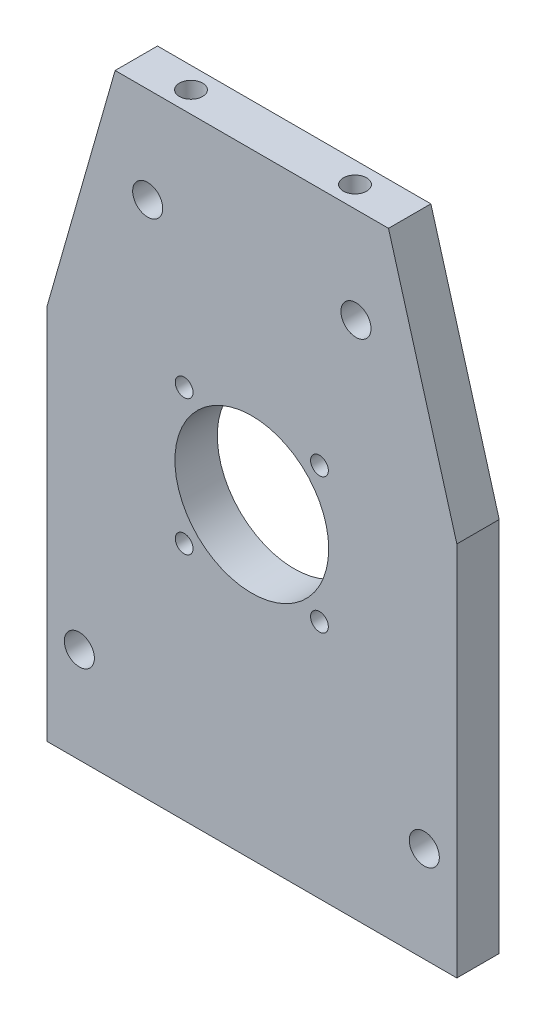
from build123d import *

# Parameters (mm, degrees)
EXTRUDE_1_4_DEPTH       = 3.1
CUT_EXTRUDE2_DEPTH      = 3.1
CUT_EXTRUDE2_DEPTH_BACK = 8
SKETCH3_R               = 11.25
SKETCH2_R               = 1.3
M3_DRILL_DEPTH          = 6.2
SKETCH4_R               = 1.7
M4_DRILL_DEPTH          = 8
SKETCH5_R               = 1.7
M4_DRILL2_DEPTH         = 8
SKETCH6_R               = 2.2
M4_THROUGH_DEPTH        = 6.2


with BuildPart() as part:
    # Sketch1 → 1/4 (new, symmetric)
    with BuildSketch(Plane.XY):
        Polygon((-20, 45), (20, 45), (30, 10), (30, -45), (-30, -45), (-30, 10), align=None)
    extrude(amount=EXTRUDE_1_4_DEPTH, both=True)

    # Sketch3 → Cut-Extrude2 (cut, two sides: drawn at the far end of the back side and taken through both)
    with BuildSketch(Plane.XY.offset(-CUT_EXTRUDE2_DEPTH_BACK)):
        Circle(SKETCH3_R)
    extrude(amount=CUT_EXTRUDE2_DEPTH + CUT_EXTRUDE2_DEPTH_BACK, mode=Mode.SUBTRACT)

    # Sketch2 → M3_DRILL (cut)
    with BuildSketch(Plane.XY.offset(3.1)):
        with Locations((-9.899494937, 9.899494937)):
            Circle(SKETCH2_R)
        with Locations((9.899494937, 9.899494937)):
            Circle(SKETCH2_R)
        with Locations((9.899494937, -9.899494937)):
            Circle(SKETCH2_R)
        with Locations((-9.899494937, -9.899494937)):
            Circle(SKETCH2_R)
    extrude(amount=-M3_DRILL_DEPTH, mode=Mode.SUBTRACT)

    # Sketch4 → M4_DRILL (cut)
    with BuildSketch(Plane(origin=(0, 45, 0), x_dir=(1, 0, 0), z_dir=(0, 1, 0))):
        with Locations(Location((-12, 0, 0), (0, 0, 180))):
            Circle(SKETCH4_R)
        with Locations((12, 0)):
            Circle(SKETCH4_R)
    extrude(amount=-M4_DRILL_DEPTH, mode=Mode.SUBTRACT)

    # Sketch5 → M4_DRILL2 (cut)
    with BuildSketch(Plane(origin=(0, -45, 0), x_dir=(-1, 0, 0), z_dir=(0, -1, 0))):
        with Locations(Location((-20, 0, 0), (0, 0, 180))):
            Circle(SKETCH5_R)
        with Locations((20, 0)):
            Circle(SKETCH5_R)
        with Locations(Location((0, 0, 0), (0, 0, 180))):
            Circle(SKETCH5_R)
    extrude(amount=-M4_DRILL2_DEPTH, mode=Mode.SUBTRACT)

    # Sketch6 → M4_through (cut)
    with BuildSketch(Plane.XY.offset(3.1)):
        with Locations((-25.2375, -31)):
            Circle(SKETCH6_R)
        with Locations((25.2375, -31)):
            Circle(SKETCH6_R)
        with Locations((-15.2375, 31)):
            Circle(SKETCH6_R)
        with Locations((15.2375, 31)):
            Circle(SKETCH6_R)
    extrude(amount=-M4_THROUGH_DEPTH, mode=Mode.SUBTRACT)


solid = part.part
